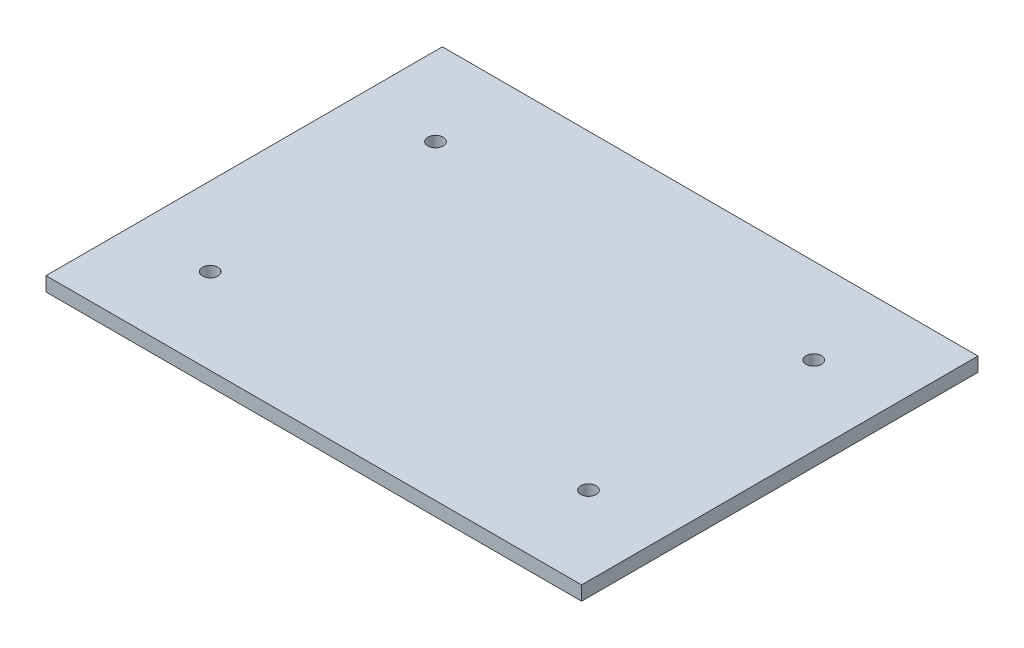
from build123d import *

# Parameters (mm, degrees)
SKETCH1_W           = 227
SKETCH1_H           = 168
BOSS_EXTRUDE1_DEPTH = 6
SKETCH2_R           = 3.25
CUT_EXTRUDE1_DEPTH  = 10


with BuildPart() as part:
    # Sketch1 → Boss-Extrude1 (new body)
    with BuildSketch(Plane(origin=(0, 0, 0), x_dir=(1, 0, 0), z_dir=(0, 1, 0))):
        with Locations((9.236267745, -41.327966645)):
            Rectangle(SKETCH1_W, SKETCH1_H)
    extrude(amount=BOSS_EXTRUDE1_DEPTH)

    # Sketch2 → Cut-Extrude1 (cut)
    with BuildSketch(Plane(origin=(0, 6, 0), x_dir=(1, 0, 0), z_dir=(0, 1, 0))):
        with Locations(Location((89.409852644, -89.080258591, 0), (0, 0, 270))):
            Circle(SKETCH2_R)
        with Locations(Location((-70.937317153, -89.080258591, 0), (0, 0, 270))):
            Circle(SKETCH2_R)
        with Locations(Location((89.409852644, 6.424325301, 0), (0, 0, 270))):
            Circle(SKETCH2_R)
        with Locations(Location((-70.937317153, 6.424325301, 0), (0, 0, 270))):
            Circle(SKETCH2_R)
    extrude(amount=-CUT_EXTRUDE1_DEPTH, mode=Mode.SUBTRACT)


solid = part.part
